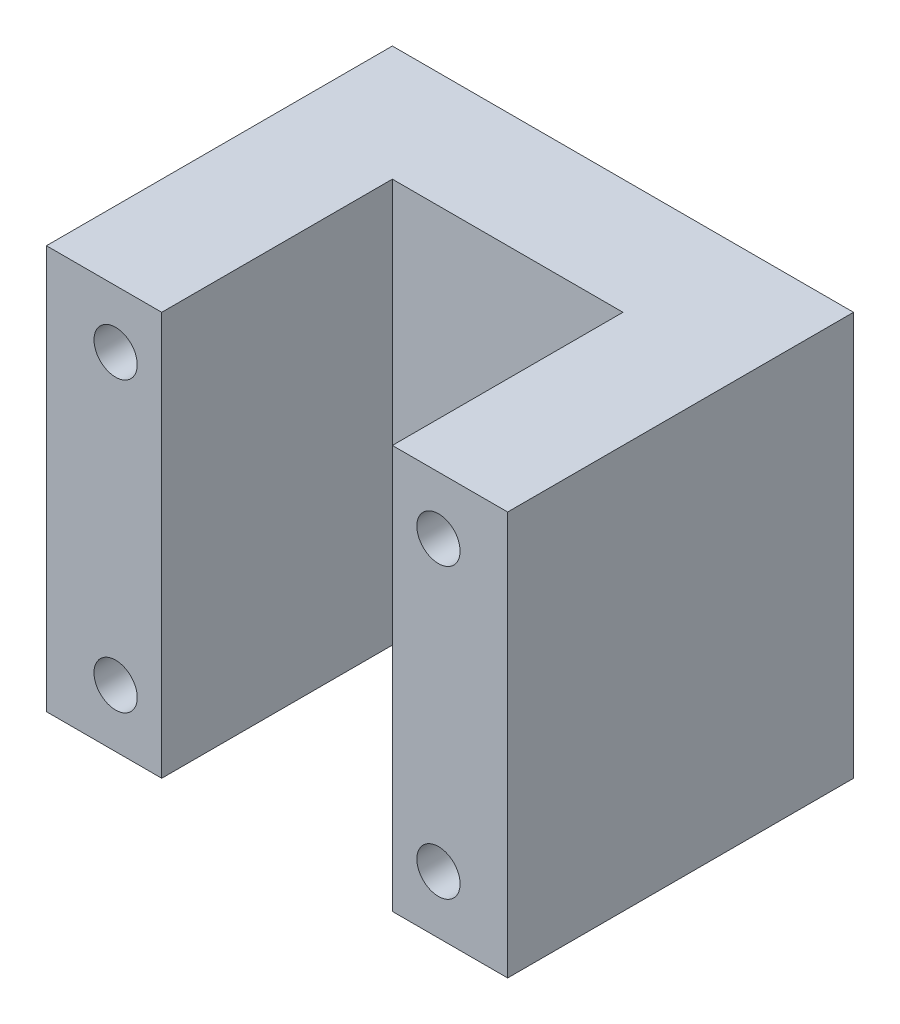
from build123d import *

# Parameters (mm, degrees)
BOSS_EXTRUDE1_DEPTH     = 17.5
CUT_EXTRUDE1_DEPTH      = 10
CUT_EXTRUDE1_DEPTH_BACK = 34.260336739
CUT_EXTRUDE1_START      = -20
SKETCH3_R               = 3.375
SKETCH3_R_2             = 1.875
CUT_EXTRUDE6_DEPTH      = 34.260336739
CUT_EXTRUDE6_DEPTH_BACK = 34.260336739
SKETCH3_4_R             = 1.875
SKETCH3_4_R_2           = 3


with BuildPart() as part:
    # Sketch1 → Boss-Extrude1 (new, symmetric)
    with BuildSketch(Plane(origin=(0, 0, 0), x_dir=(1, 0, 0), z_dir=(0, 1, 0))):
        Polygon((-20, 20), (20, 20), (20, -10), (10, -10), (10, 10), (-10, 10), (-10, -10), (-20, -10), align=None)
    extrude(amount=BOSS_EXTRUDE1_DEPTH, both=True)

    # Sketch3 → Cut-Extrude1 (cut, two sides: drawn at the far end of the back side and taken through both)
    # profile 1 of 4: a face of its own
    with BuildSketch(Plane.XY.offset(CUT_EXTRUDE1_START - CUT_EXTRUDE1_DEPTH_BACK)):
        with Locations((-14, 12.5)):
            Circle(SKETCH3_R)
        with Locations((-14, 12.5)):
            Circle(SKETCH3_R_2, mode=Mode.SUBTRACT)
    # profile 2 of 4: a face of its own
    with BuildSketch(Plane.XY.offset(CUT_EXTRUDE1_START - CUT_EXTRUDE1_DEPTH_BACK)):
        with Locations((14, 12.5)):
            Circle(SKETCH3_R)
        with Locations((14, 12.5)):
            Circle(SKETCH3_R_2, mode=Mode.SUBTRACT)
    # profile 3 of 4: a face of its own
    with BuildSketch(Plane.XY.offset(CUT_EXTRUDE1_START - CUT_EXTRUDE1_DEPTH_BACK)):
        with Locations((14, -12.5)):
            Circle(SKETCH3_R)
        with Locations((14, -12.5)):
            Circle(SKETCH3_R_2, mode=Mode.SUBTRACT)
    # profile 4 of 4: a face of its own
    with BuildSketch(Plane.XY.offset(CUT_EXTRUDE1_START - CUT_EXTRUDE1_DEPTH_BACK)):
        with Locations((-14, -12.5)):
            Circle(SKETCH3_R)
        with Locations((-14, -12.5)):
            Circle(SKETCH3_R_2, mode=Mode.SUBTRACT)
    extrude(amount=CUT_EXTRUDE1_DEPTH + CUT_EXTRUDE1_DEPTH_BACK, mode=Mode.SUBTRACT)

    # Sketch3<4> → Cut-Extrude6 (cut, two sides: drawn at the far end of the back side and taken through both)
    with BuildSketch(Plane.XY.offset(-CUT_EXTRUDE6_DEPTH_BACK)):
        with Locations((-14, 12.5)):
            Circle(SKETCH3_4_R)
        with Locations((-14, -12.5)):
            Circle(SKETCH3_4_R)
        with Locations((14, -12.5)):
            Circle(SKETCH3_4_R)
        with Locations((14, 12.5)):
            Circle(SKETCH3_4_R)
        Circle(SKETCH3_4_R_2)
    extrude(amount=CUT_EXTRUDE6_DEPTH + CUT_EXTRUDE6_DEPTH_BACK, mode=Mode.SUBTRACT)


solid = part.part
